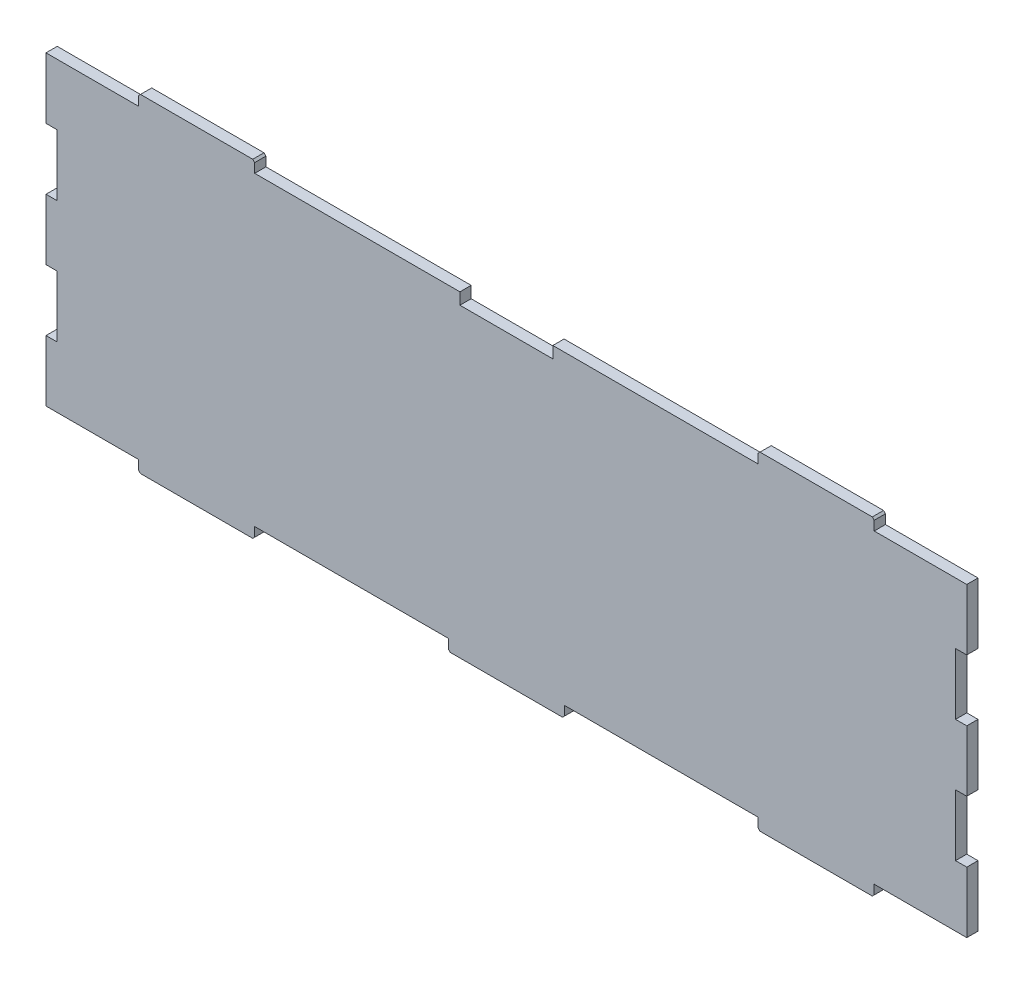
from build123d import *

# Parameters (mm, degrees)
BOSS_EXTRUDE1_DEPTH = 2.9


with BuildPart() as part:
    # Sketch1 → Boss-Extrude1 (new body)
    with BuildSketch(Plane.XY.offset(135)):
        Polygon((-118.9, 2.9), (-95, 2.9), (-95, 0.5), (-94.5, 0), (-65.5, 0), (-65, 0.5), (-65, 2.9), (-15, 2.9), (-15, 0.5), (-14.5, 0), (14.5, 0), (15, 0.5), (15, 2.9), (65, 2.9), (65, 0.5), (65.5, 0), (94.5, 0), (95, 0.5), (95, 2.9), (118.9, 2.9), (118.9, 18.675), (116, 18.675), (116, 34.525), (118.9, 34.525), (118.9, 50.275), (116, 50.275), (116, 66.125), (118.9, 66.125), (118.9, 81.9), (95, 81.9), (95, 84.3), (94.5, 84.8), (65.5, 84.8), (65, 84.3), (65, 81.9), (12, 81.9), (12, 78.9), (-12, 78.9), (-12, 81.9), (-65, 81.9), (-65, 84.3), (-65.5, 84.8), (-94.5, 84.8), (-95, 84.3), (-95, 81.9), (-118.9, 81.9), (-118.9, 66.125), (-116, 66.125), (-116, 50.275), (-118.9, 50.275), (-118.9, 34.525), (-116, 34.525), (-116, 18.675), (-118.9, 18.675), align=None)
    extrude(amount=BOSS_EXTRUDE1_DEPTH)


solid = part.part
